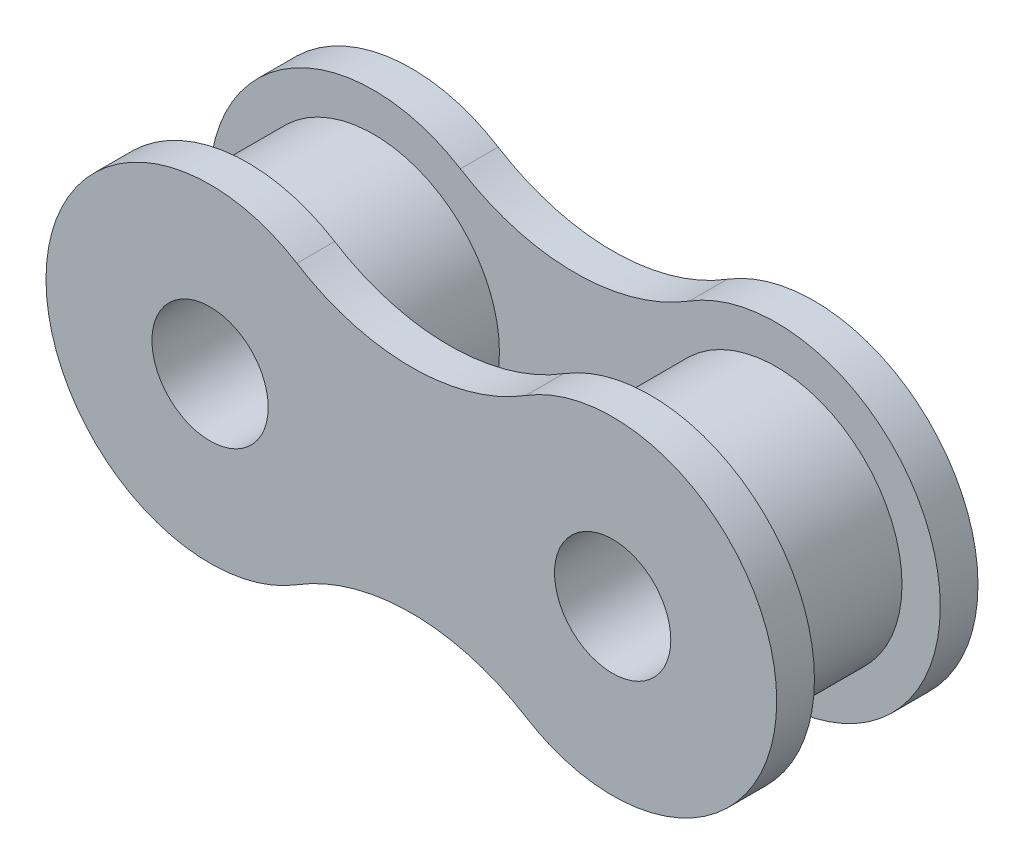
from build123d import *

# Parameters (mm, degrees)
SKETCH4_R           = 1.155
BOSS_EXTRUDE1_DEPTH = 0.75
SKETCH6_R           = 2.5
SKETCH6_R_2         = 1.155
BOSS_EXTRUDE2_DEPTH = 3.25


with BuildPart() as part:
    # Sketch4 → Boss-Extrude1 (new body)
    with BuildSketch(Plane.XY.offset(-4.75)):
        with BuildLine():
            ThreePointArc((-2.275132275, 2.766302827), (0, 2.11510717), (2.275132275, 2.766302827))
            ThreePointArc((2.275132275, 2.766302827), (7.26, 0), (2.275132275, -2.766302827))
            ThreePointArc((2.275132275, -2.766302827), (0, -2.11510717), (-2.275132275, -2.766302827))
            ThreePointArc((-2.275132275, -2.766302827), (-7.26, 0), (-2.275132275, 2.766302827))
        make_face()
        with Locations((-4, 0)):
            Circle(SKETCH4_R, mode=Mode.SUBTRACT)
        with Locations((4, 0)):
            Circle(SKETCH4_R, mode=Mode.SUBTRACT)
    boss_extrude1 = extrude(amount=BOSS_EXTRUDE1_DEPTH)

    # Sketch6 → Boss-Extrude2 (add)
    # profile 1 of 2: a face of its own
    with BuildSketch(Plane.XY.offset(-4)):
        with Locations(Location((-4, 0, 0), (0, 0, 180))):
            Circle(SKETCH6_R)
        with Locations((-4, 0)):
            Circle(SKETCH6_R_2, mode=Mode.SUBTRACT)
    # profile 2 of 2: a face of its own
    with BuildSketch(Plane.XY.offset(-4)):
        with Locations(Location((4, 0, 0), (0, 0, 180))):
            Circle(SKETCH6_R)
        with Locations((4, 0)):
            Circle(SKETCH6_R_2, mode=Mode.SUBTRACT)
    extrude(amount=BOSS_EXTRUDE2_DEPTH)

    # Mirror1: Boss-Extrude1 across plane
    add(boss_extrude1.mirror(Plane.XY.offset(-2.75)))


solid = part.part
